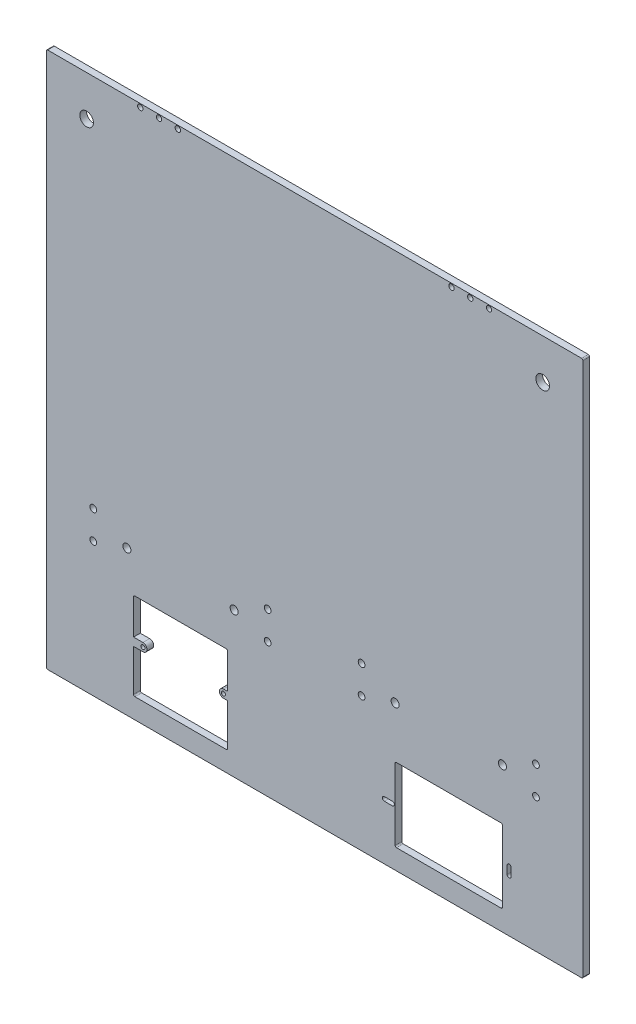
from build123d import *

# Parameters (mm, degrees)
SKETCH1_R           = 2.5
SKETCH1_R_2         = 3
SKETCH1_R_3         = 2
SKETCH1_R_4         = 5.1
BOSS_EXTRUDE1_DEPTH = 5
SKETCH2_R           = 2
CUT_EXTRUDE1_DEPTH  = 8
SKETCH3_R           = 1.5
BOSS_EXTRUDE2_DEPTH = 5


with BuildPart() as part:
    # Sketch1 → Boss-Extrude1 (new body)
    with BuildSketch(Plane.XY):
        with BuildLine():
            Line((1, 0), (399, 0))
            ThreePointArc((399, 0), (399.707106781, 0.292893219), (400, 1))
            Line((400, 1), (400, 399))
            ThreePointArc((400, 399), (399.707106781, 399.707106781), (399, 400))
            Line((399, 400), (1, 400))
            ThreePointArc((1, 400), (0.292893219, 399.707106781), (0, 399))
            Line((0, 399), (0, 1))
            ThreePointArc((0, 1), (0.292893219, 0.292893219), (1, 0))
        make_face()
        with Locations((35, 121)):
            Circle(SKETCH1_R, mode=Mode.SUBTRACT)
        with Locations((35, 100)):
            Circle(SKETCH1_R, mode=Mode.SUBTRACT)
        with Locations((60, 108)):
            Circle(SKETCH1_R_2, mode=Mode.SUBTRACT)
        with Locations((140, 108)):
            Circle(SKETCH1_R_2, mode=Mode.SUBTRACT)
        with Locations((165, 121)):
            Circle(SKETCH1_R, mode=Mode.SUBTRACT)
        with Locations((165, 100)):
            Circle(SKETCH1_R, mode=Mode.SUBTRACT)
        with Locations((235, 121)):
            Circle(SKETCH1_R, mode=Mode.SUBTRACT)
        with Locations((235, 100)):
            Circle(SKETCH1_R, mode=Mode.SUBTRACT)
        with Locations((260, 108)):
            Circle(SKETCH1_R_2, mode=Mode.SUBTRACT)
        with Locations((340, 108)):
            Circle(SKETCH1_R_2, mode=Mode.SUBTRACT)
        with Locations((365, 121)):
            Circle(SKETCH1_R, mode=Mode.SUBTRACT)
        with Locations((365, 100)):
            Circle(SKETCH1_R, mode=Mode.SUBTRACT)
        with Locations((70, 397.5)):
            Circle(SKETCH1_R_3, mode=Mode.SUBTRACT)
        with Locations((84, 397.5)):
            Circle(SKETCH1_R_3, mode=Mode.SUBTRACT)
        with Locations((98, 397.5)):
            Circle(SKETCH1_R_3, mode=Mode.SUBTRACT)
        with Locations((302, 397.5)):
            Circle(SKETCH1_R_3, mode=Mode.SUBTRACT)
        with Locations((316, 397.5)):
            Circle(SKETCH1_R_3, mode=Mode.SUBTRACT)
        with Locations((330, 397.5)):
            Circle(SKETCH1_R_3, mode=Mode.SUBTRACT)
        with Locations((30, 370)):
            Circle(SKETCH1_R_4, mode=Mode.SUBTRACT)
        with Locations((370, 370)):
            Circle(SKETCH1_R_4, mode=Mode.SUBTRACT)
        with BuildLine():
            Line((261, 70), (339, 70))
            ThreePointArc((339, 70), (339.707106781, 69.707106781), (340, 69))
            Line((340, 69), (340, 16))
            ThreePointArc((340, 16), (339.707106781, 15.292893219), (339, 15))
            Line((339, 15), (261, 15))
            ThreePointArc((261, 15), (260.292893219, 15.292893219), (260, 16))
            Line((260, 16), (260, 69))
            ThreePointArc((260, 69), (260.292893219, 69.707106781), (261, 70))
        make_face(mode=Mode.SUBTRACT)
        with BuildLine():
            Line((66, 80), (134, 80))
            ThreePointArc((134, 80), (134.707106781, 79.707106781), (135, 79))
            Line((135, 79), (135, 16))
            ThreePointArc((135, 16), (134.707106781, 15.292893219), (134, 15))
            Line((134, 15), (66, 15))
            ThreePointArc((66, 15), (65.292893219, 15.292893219), (65, 16))
            Line((65, 16), (65, 79))
            ThreePointArc((65, 79), (65.292893219, 79.707106781), (66, 80))
        make_face(mode=Mode.SUBTRACT)
        with BuildLine():
            Line((346.5, 45), (346.5, 39))
            ThreePointArc((346.5, 39), (345, 37.5), (343.5, 39))
            Line((343.5, 39), (343.5, 45))
            ThreePointArc((343.5, 45), (345, 46.5), (346.5, 45))
        make_face(mode=Mode.SUBTRACT)
        with BuildLine():
            Line((252, 43.5), (258, 43.5))
            ThreePointArc((258, 43.5), (259.5, 42), (258, 40.5))
            Line((258, 40.5), (252, 40.5))
            ThreePointArc((252, 40.5), (250.5, 42), (252, 43.5))
        make_face(mode=Mode.SUBTRACT)
    extrude(amount=BOSS_EXTRUDE1_DEPTH)

    # Sketch2 → Cut-Extrude1 (cut)
    with BuildSketch(Plane.XZ):
        with Locations(Location((193, 2.5, 0), (0, 0, 270))):
            Circle(SKETCH2_R)
        with Locations(Location((207, 2.5, 0), (0, 0, 270))):
            Circle(SKETCH2_R)
    extrude(amount=-CUT_EXTRUDE1_DEPTH, mode=Mode.SUBTRACT)

    # Sketch3 → Boss-Extrude2 (add)
    # profile 1 of 2: a face of its own
    with BuildSketch(Plane.XY):
        with BuildLine():
            Line((132, 53), (135, 53))
            Line((135, 53), (135, 47))
            Line((135, 47), (132, 47))
            ThreePointArc((132, 47), (129, 50), (132, 53))
        make_face()
        with Locations((132, 50)):
            Circle(SKETCH3_R, mode=Mode.SUBTRACT)
    # profile 2 of 2: a face of its own
    with BuildSketch(Plane.XY):
        with BuildLine():
            Line((72, 47), (65, 47))
            Line((65, 47), (65, 53))
            Line((65, 53), (72, 53))
            ThreePointArc((72, 53), (75, 50), (72, 47))
        make_face()
        with Locations((72, 50)):
            Circle(SKETCH3_R, mode=Mode.SUBTRACT)
    extrude(amount=BOSS_EXTRUDE2_DEPTH)


solid = part.part
